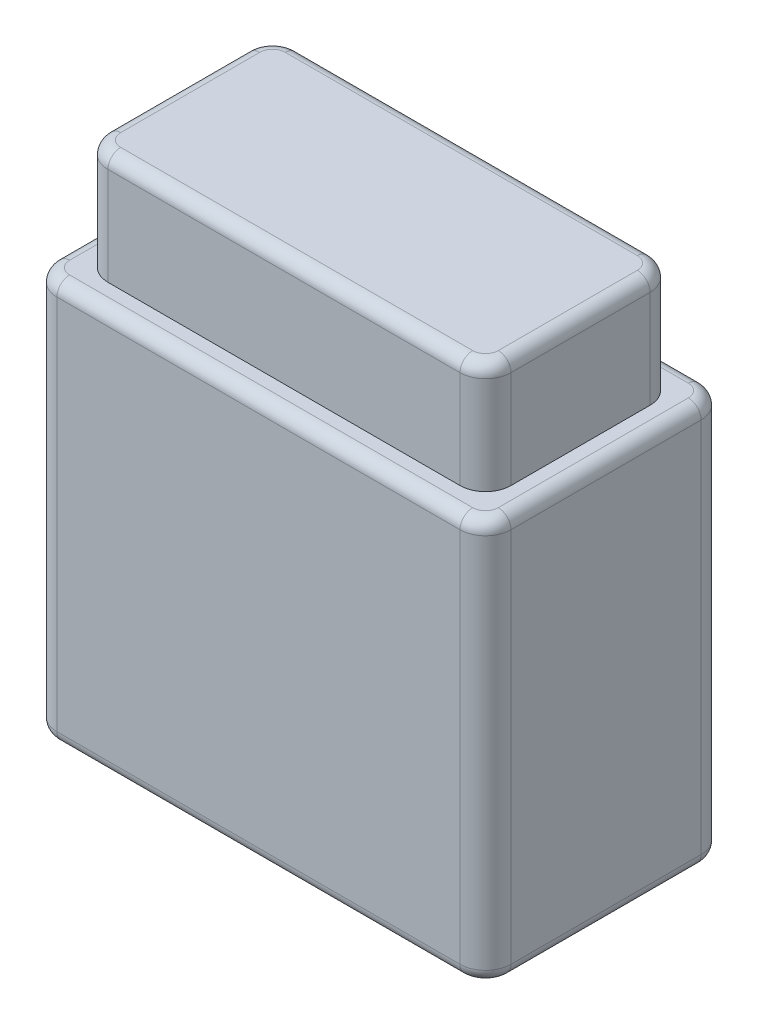
from build123d import *

# Parameters (mm, degrees)
BOSS_EXTRUDE1_DEPTH = 400
FILLET1_R           = 12.7
BOSS_EXTRUDE3_DEPTH = 110
FILLET2_R           = 12.7


with BuildPart() as part:
    # Sketch1 → Boss-Extrude1 (new body)
    with BuildSketch(Plane(origin=(0, 0, 0), x_dir=(1, 0, 0), z_dir=(0, 1, 0))):
        with BuildLine():
            Line((25.4, 0), (426.6, 0))
            ThreePointArc((426.6, 0), (444.560512242, 7.439487758), (452, 25.4))
            Line((452, 25.4), (452, 214.6))
            ThreePointArc((452, 214.6), (444.560512242, 232.560512242), (426.6, 240))
            Line((426.6, 240), (25.4, 240))
            ThreePointArc((25.4, 240), (7.439487758, 232.560512242), (0, 214.6))
            Line((0, 214.6), (0, 25.4))
            ThreePointArc((0, 25.4), (7.439487758, 7.439487758), (25.4, 0))
        make_face()
    extrude(amount=BOSS_EXTRUDE1_DEPTH)

    # Fillet1
    fillet1_edges = [part.edges().sort_by_distance(p)[0] for p in [
        (226, 0, 0),
        (7.439487758, 0, -7.439487758),
        (0, 0, -120),
        (7.439487758, 0, -232.560512242),
        (7.439487758, 400, -7.439487758),
        (226, 400, 0),
        (444.560512242, 400, -7.439487758),
        (452, 400, -120),
        (444.560512242, 400, -232.560512242),
        (226, 400, -240),
        (7.439487758, 400, -232.560512242),
        (226, 0, -240),
        (0, 400, -120),
        (444.560512242, 0, -232.560512242),
        (452, 0, -120),
        (444.560512242, 0, -7.439487758),
    ]]
    fillet(fillet1_edges, radius=FILLET1_R)

    # Sketch2 → Boss-Extrude3 (add)
    with BuildSketch(Plane(origin=(0, 400, 0), x_dir=(1, 0, 0), z_dir=(0, 1, 0))):
        with BuildLine():
            Line((50.8, 25.4), (401.2, 25.4))
            ThreePointArc((401.2, 25.4), (419.160512242, 32.839487758), (426.6, 50.8))
            Line((426.6, 50.8), (426.6, 189.2))
            ThreePointArc((426.6, 189.2), (419.160512242, 207.160512242), (401.2, 214.6))
            Line((401.2, 214.6), (50.8, 214.6))
            ThreePointArc((50.8, 214.6), (32.839487758, 207.160512242), (25.4, 189.2))
            Line((25.4, 189.2), (25.4, 50.8))
            ThreePointArc((25.4, 50.8), (32.839487758, 32.839487758), (50.8, 25.4))
        make_face()
    extrude(amount=BOSS_EXTRUDE3_DEPTH)

    # Fillet2
    fillet2_edges = [part.edges().sort_by_distance(p)[0] for p in [
        (419.160512242, 510, -207.160512242),
        (226, 510, -214.6),
        (32.839487758, 510, -207.160512242),
        (25.4, 510, -120),
        (32.839487758, 510, -32.839487758),
        (226, 510, -25.4),
        (419.160512242, 510, -32.839487758),
        (426.6, 510, -120),
    ]]
    fillet(fillet2_edges, radius=FILLET2_R)


solid = part.part
